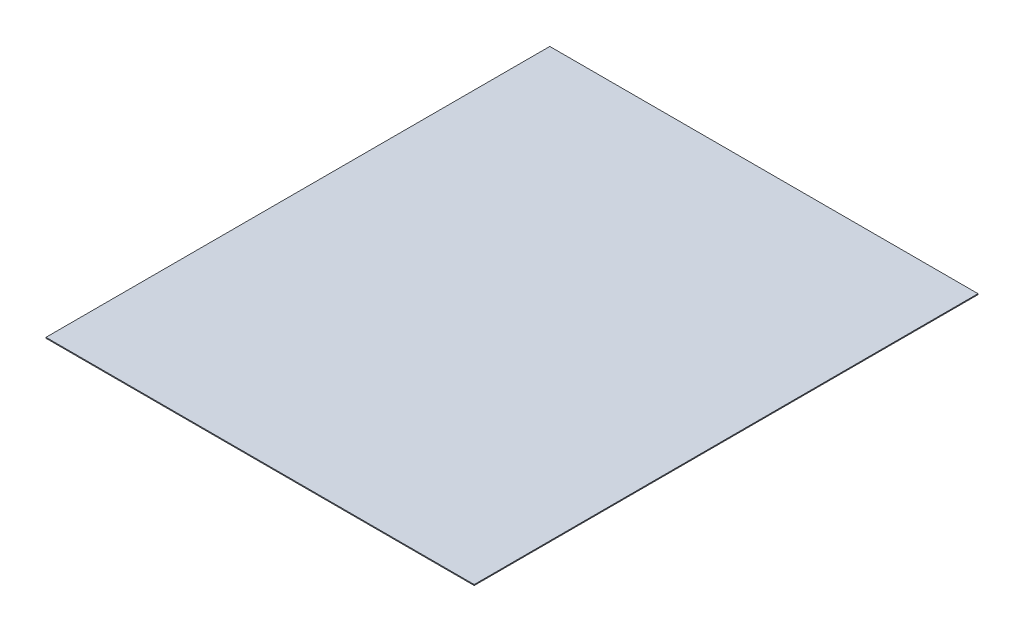
from build123d import *

# Parameters (mm, degrees)
SKETCH1_W            = 697
SKETCH1_H            = 1.5
OVEN_DIS_UST_1_DEPTH = 820


with BuildPart() as part:
    # Sketch1 → OVEN_dis_ust_1 (new body)
    with BuildSketch(Plane.XY):
        with Locations((350, 1969.25)):
            Rectangle(SKETCH1_W, SKETCH1_H)
    extrude(amount=-OVEN_DIS_UST_1_DEPTH)


solid = part.part
